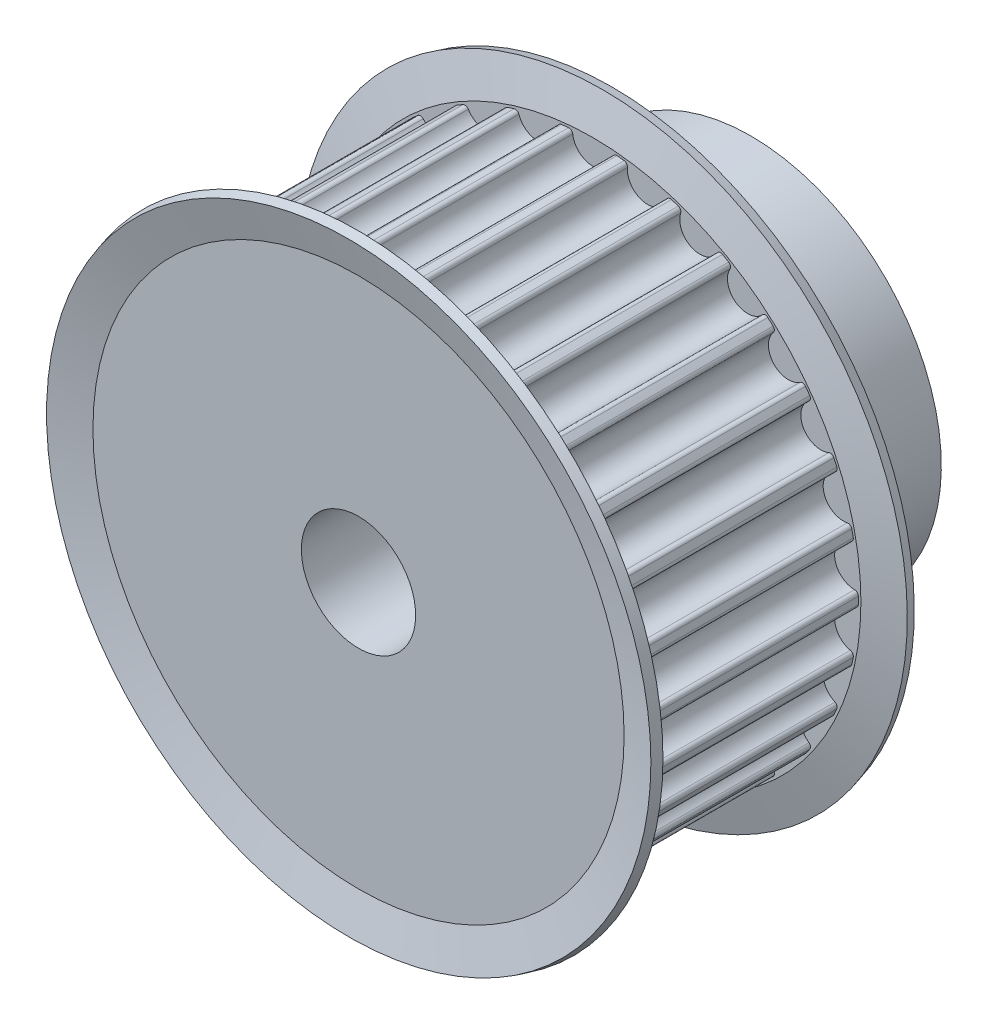
from build123d import *

# Parameters (mm, degrees)
SKETCH5_W           = 12.8
SKETCH5_H           = 13.945
SKETCH16_W          = 7.8
SKETCH16_H          = 10
SKETCH17_W          = 20.6
SKETCH17_H          = 3
CUT_TOOTH_REACH     = 30.518
PATTERN_TOOTH_COUNT = 30


with BuildPart() as part:
    # Sketch5 → body (revolve)
    with BuildSketch(Plane(origin=(0, 0, 0), x_dir=(0, 0, -1), z_dir=(1, 0, 0))):
        with Locations((6.4, 6.9725)):
            Rectangle(SKETCH5_W, SKETCH5_H)
    revolve(axis=Axis((0, 0, 0), (0, 0, -1)))

    # Sketch16 → body-hub (revolve)
    with BuildSketch(Plane(origin=(0, 0, 0), x_dir=(0, 0, -1), z_dir=(1, 0, 0))):
        with Locations((16.7, 5)):
            Rectangle(SKETCH16_W, SKETCH16_H)
    revolve(axis=Axis((0, 0, -20.6), (0, 0, 1)))

    # Sketch17 → body-bore (revolve, cut)
    with BuildSketch(Plane(origin=(0, 0, 0), x_dir=(0, 0, -1), z_dir=(1, 0, 0))):
        with Locations((10.3, 1.5)):
            Rectangle(SKETCH17_W, SKETCH17_H)
    revolve(axis=Axis((0, 0, -20.6), (0, 0, 1)), mode=Mode.SUBTRACT)

    # Sketch23 → cut-tooth (cut, up to next)
    with BuildSketch(Plane.XY, mode=Mode.PRIVATE) as cut_tooth_sk1:
        with BuildLine():
            Line((1.271118149, 13.88694652), (1.271118149, 15.185))
            Line((1.271118149, 15.185), (-1.271118149, 15.185))
            Line((-1.271118149, 15.185), (-1.271118149, 13.88694652))
            ThreePointArc((-1.271118149, 13.88694652), (-1.125115062, 13.842627086), (-1.051414772, 13.709025511))
            ThreePointArc((-1.051414772, 13.709025511), (0, 12.775), (1.051414772, 13.709025511))
            ThreePointArc((1.051414772, 13.709025511), (1.125115062, 13.842627086), (1.271118149, 13.88694652))
        make_face()
    cut_tooth_tool1 = extrude(cut_tooth_sk1.sketch, amount=-CUT_TOOTH_REACH, mode=Mode.PRIVATE) & part.part
    cut_tooth = cut_tooth_tool1.solids().sort_by_distance((0, 14.128511, 0))[0]
    add(cut_tooth, mode=Mode.SUBTRACT)

    # pattern-tooth: cut-tooth ×30 about axis
    pattern_tooth_axis = Axis((0, 0, -12.8), (0, 0, 1))
    for i in range(1, PATTERN_TOOTH_COUNT):
        add(cut_tooth.rotate(pattern_tooth_axis, i * 360 / PATTERN_TOOTH_COUNT), mode=Mode.SUBTRACT)

    # Sketch25 → body-flange-front (revolve)
    with BuildSketch(Plane(origin=(0, 0, 0), x_dir=(0, 0, -1), z_dir=(1, 0, 0))):
        Polygon((0.5, 12.13625), (0, 12.13625), (0, 13.945), (-0.514737206, 15.866025404), (-0.014737206, 16), (0.5, 14.078974596), align=None)
    revolve(axis=Axis((0, 0, 0), (0, 0, -1)))

    # Sketch26 → body-flange-back (revolve)
    with BuildSketch(Plane(origin=(0, 0, 0), x_dir=(0, 0, -1), z_dir=(1, 0, 0))):
        Polygon((12.3, 12.13625), (12.8, 12.13625), (12.8, 13.945), (13.314737206, 15.866025404), (12.814737206, 16), (12.3, 14.078974596), align=None)
    revolve(axis=Axis((0, 0, -12.8), (0, 0, 1)))


solid = part.part
